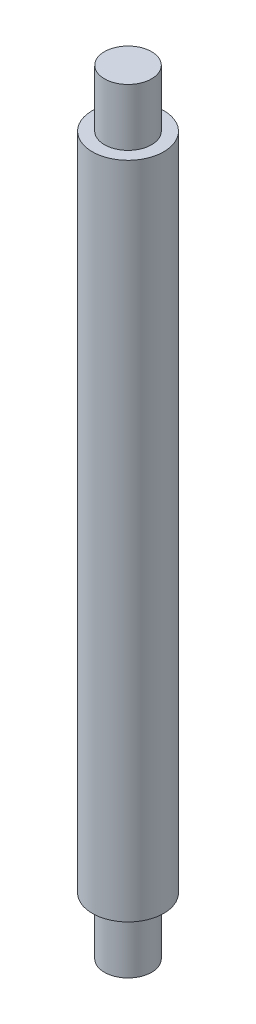
from build123d import *

# Parameters (mm, degrees)
ESBO_O1_R                = 5
RESSALTO_EXTRUS_O1_DEPTH = 54.2
ESBO_O2_R                = 5
ESBO_O2_R_2              = 3.3
CORTE_EXTRUS_O1_DEPTH    = 8


with BuildPart() as part:
    # Esboço1 → Ressalto-extrusão1 (new, symmetric)
    with BuildSketch(Plane(origin=(0, 0, 0), x_dir=(1, 0, 0), z_dir=(0, 1, 0))):
        with Locations(Location((0, 0, 0), (0, 0, 90))):
            Circle(ESBO_O1_R)
    extrude(amount=RESSALTO_EXTRUS_O1_DEPTH, both=True)

    # Esboço2 → Corte-extrusão1 (cut)
    with BuildSketch(Plane(origin=(0, 54.2, 0), x_dir=(1, 0, 0), z_dir=(0, 1, 0))):
        with Locations(Location((0, 0, 0), (0, 0, 90))):
            Circle(ESBO_O2_R)
        with Locations(Location((0, 0, 0), (0, 0, 270))):
            Circle(ESBO_O2_R_2, mode=Mode.SUBTRACT)
    corte_extrus_o1 = extrude(amount=-CORTE_EXTRUS_O1_DEPTH, mode=Mode.SUBTRACT)

    # Espelhar1: Corte-extrusão1 across plane
    add(corte_extrus_o1.mirror(Plane.ZX), mode=Mode.SUBTRACT)


solid = part.part
